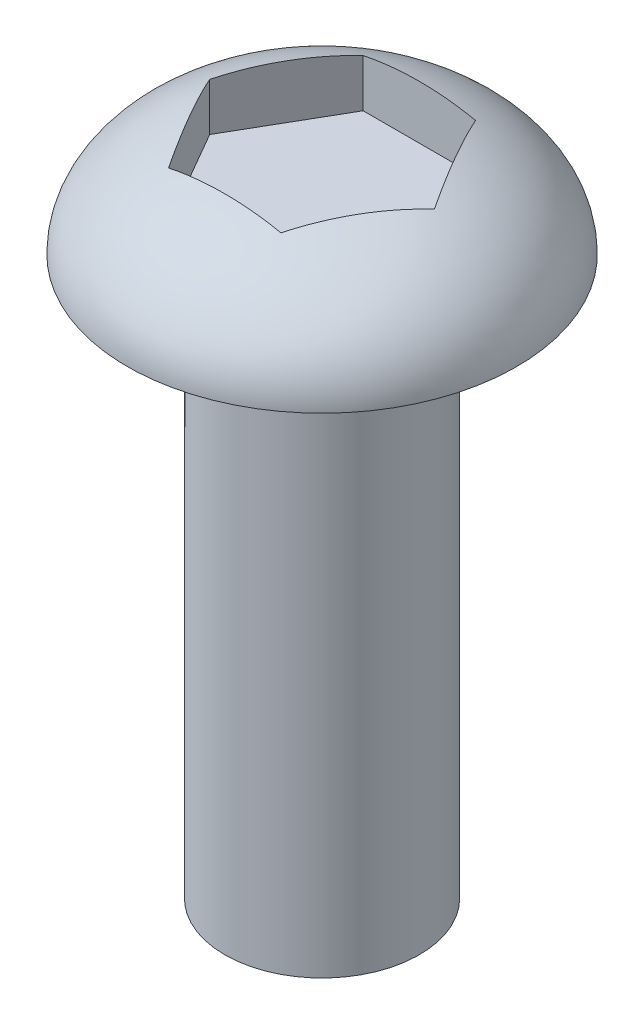
from build123d import *

# Parameters (mm, degrees)
SKETCH1_R           = 2.5
BOSS_EXTRUDE1_DEPTH = 14.334
CUT_EXTRUDE1_DEPTH  = 1.778


with BuildPart() as part:
    # Sketch1 → Boss-Extrude1 (new body)
    with BuildSketch(Plane(origin=(0, 0, 0), x_dir=(1, 0, 0), z_dir=(0, 1, 0))):
        with Locations(Location((0, 0, 0), (0, 0, 270))):
            Circle(SKETCH1_R)
    extrude(amount=BOSS_EXTRUDE1_DEPTH)

    # Sketch2 → Revolve1 (revolve)
    with BuildSketch(Plane(origin=(0, 0, 0), x_dir=(0, 0, -1), z_dir=(1, 0, 0))):
        with BuildLine():
            Line((0, 14.334), (5, 14.334))
            add(Edge.make_bspline(
                [(5, 14.334), (5, 17.334), (0, 17.334)],
                knots=[0, 0, 0, 1.570796327, 1.570796327, 1.570796327], degree=2, weights=[1, 0.707106781, 1]))
            Line((0, 17.334), (0, 14.334))
        make_face()
    revolve(axis=Axis((0, 14.334, 0), (0, 1, 0)))

    # Sketch4 → Cut-Extrude1 (cut)
    with BuildSketch(Plane(origin=(0, 17.334, 0), x_dir=(1, 0, 0), z_dir=(0, 1, 0))):
        Polygon((2.886751346, 0), (1.443375673, 2.5), (-1.443375673, 2.5), (-2.886751346, 0), (-1.443375673, -2.5), (1.443375673, -2.5), align=None)
    extrude(amount=-CUT_EXTRUDE1_DEPTH, mode=Mode.SUBTRACT)


solid = part.part
